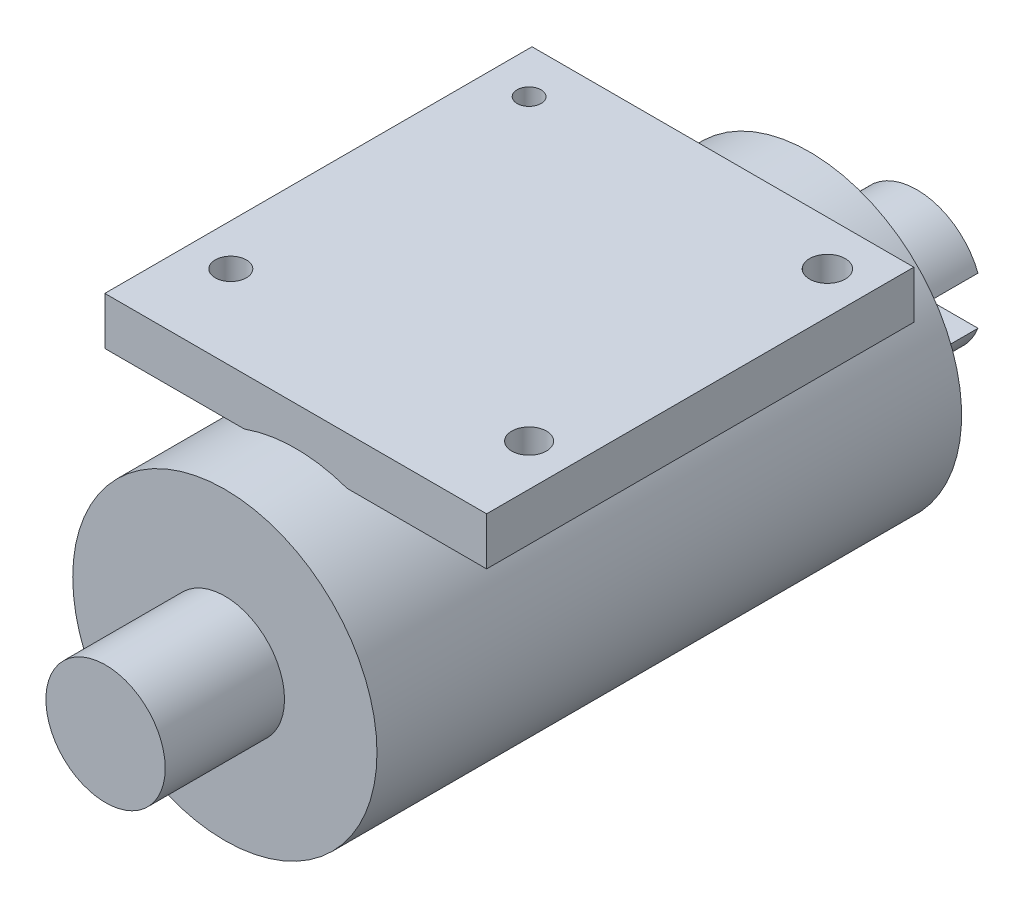
from build123d import *

# Parameters (mm, degrees)
SKETCH1_R           = 25.5
BOSS_EXTRUDE1_DEPTH = 116
SKETCH3_OUTSIDE_W   = 80.318
SKETCH3_OUTSIDE_H   = 80.318
SKETCH3_OUTSIDE_R   = 11
CUT_EXTRUDE2_DEPTH  = 18
SKETCH4_W           = 35.319317214
SKETCH4_H           = 8
CUT_EXTRUDE3_DEPTH  = 12
SKETCH5_W           = 64
SKETCH5_H           = 71.607933851
SKETCH5_R           = 2.910259783
SKETCH5_R_2         = 2.987781855
SKETCH5_R_3         = 2.610532629
SKETCH5_R_4         = 2.006978968
BOSS_EXTRUDE2_DEPTH = 8
SKETCH6_R           = 10
BOSS_EXTRUDE3_DEPTH = 20


with BuildPart() as part:
    # Sketch1 → Boss-Extrude1 (new body)
    with BuildSketch(Plane.XY):
        with Locations(Location((0, 0, 0), (0, 0, 180))):
            Circle(SKETCH1_R)
    extrude(amount=BOSS_EXTRUDE1_DEPTH)

    # Sketch3 outside → Cut-Extrude2 (cut)
    with BuildSketch(Plane(origin=(0, 0, 0), x_dir=(-1, 0, 0), z_dir=(0, 0, -1))):
        Rectangle(SKETCH3_OUTSIDE_W, SKETCH3_OUTSIDE_H)
        Circle(SKETCH3_OUTSIDE_R, mode=Mode.SUBTRACT)
    extrude(amount=-CUT_EXTRUDE2_DEPTH, mode=Mode.SUBTRACT)

    # Sketch4 → Cut-Extrude3 (cut)
    with BuildSketch(Plane(origin=(0, 0, 0), x_dir=(-1, 0, 0), z_dir=(0, 0, -1))):
        with Locations((-2.725981742, 0)):
            Rectangle(SKETCH4_W, SKETCH4_H)
    extrude(amount=-CUT_EXTRUDE3_DEPTH, mode=Mode.SUBTRACT)

    # Sketch5 → Boss-Extrude2 (add)
    with BuildSketch(Plane(origin=(0, 32, 0), x_dir=(-1, 0, 0), z_dir=(0, 1, 0))):
        with Locations((0, 68.315264107)):
            Rectangle(SKETCH5_W, SKETCH5_H)
        with Locations(Location((-25, 90, 0), (0, 0, 90))):
            Circle(SKETCH5_R, mode=Mode.SUBTRACT)
        with Locations(Location((-25, 40, 0), (0, 0, 90))):
            Circle(SKETCH5_R_2, mode=Mode.SUBTRACT)
        with Locations(Location((25, 90, 0), (0, 0, 90))):
            Circle(SKETCH5_R_3, mode=Mode.SUBTRACT)
        with Locations(Location((25, 40, 0), (0, 0, 90))):
            Circle(SKETCH5_R_4, mode=Mode.SUBTRACT)
    extrude(amount=-BOSS_EXTRUDE2_DEPTH)

    # Sketch6 → Boss-Extrude3 (add)
    with BuildSketch(Plane.XY.offset(116)):
        Circle(SKETCH6_R)
    extrude(amount=BOSS_EXTRUDE3_DEPTH)


solid = part.part
